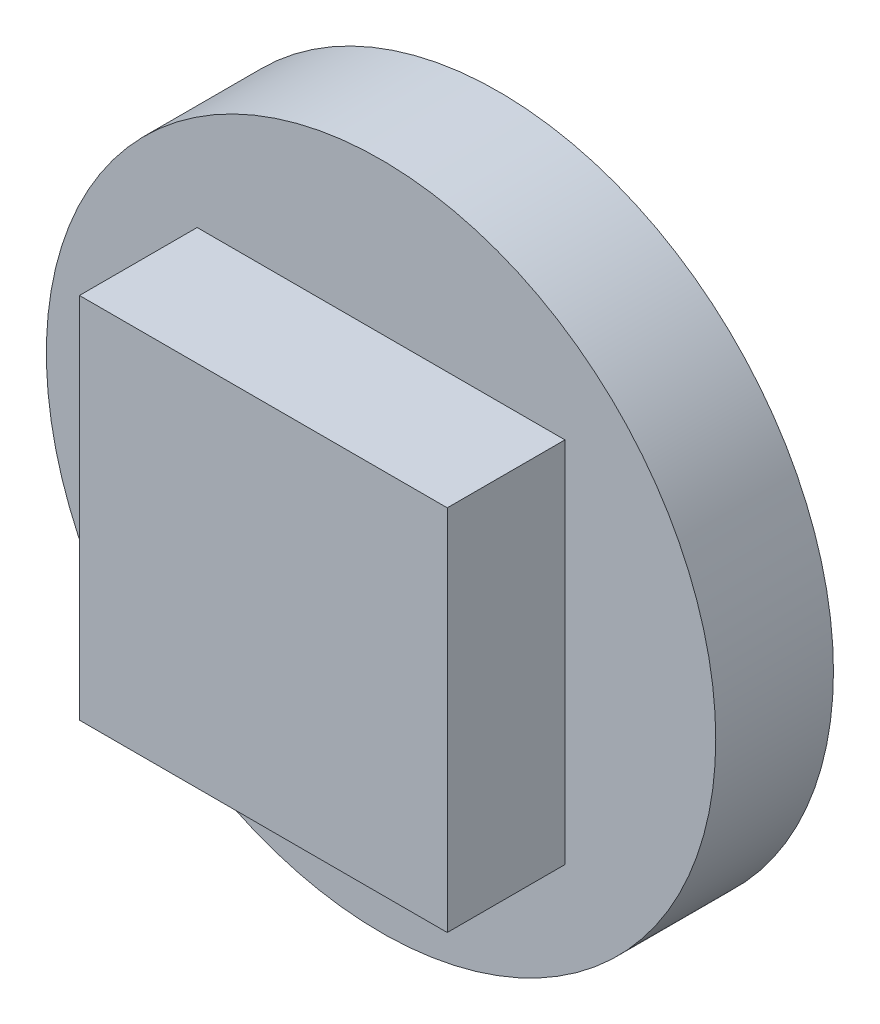
from build123d import *

# Parameters (mm, degrees)
SKETCH1_R           = 4.55
BOSS_EXTRUDE1_DEPTH = 1.6
SKETCH3_W           = 5
SKETCH3_H           = 5
BOSS_EXTRUDE2_DEPTH = 1.6


with BuildPart() as part:
    # Sketch1 → Boss-Extrude1 (new body)
    with BuildSketch(Plane.XY):
        Circle(SKETCH1_R)
    extrude(amount=BOSS_EXTRUDE1_DEPTH)

    # Sketch3 → Boss-Extrude2 (add)
    with BuildSketch(Plane.XY.offset(1.6)):
        Rectangle(SKETCH3_W, SKETCH3_H)
    extrude(amount=BOSS_EXTRUDE2_DEPTH)


solid = part.part
